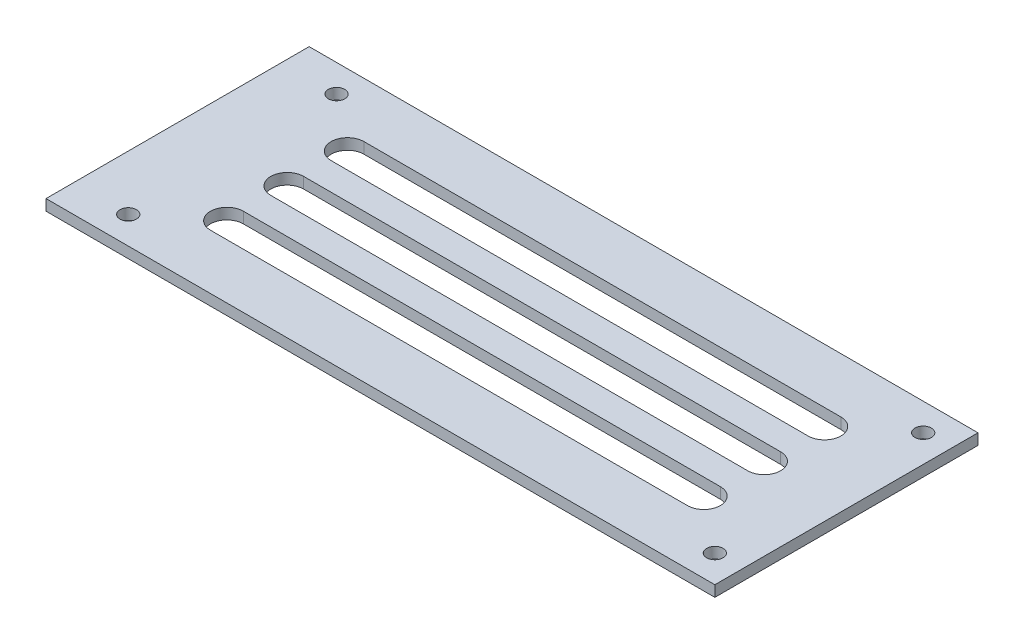
from build123d import *

# Parameters (mm, degrees)
SKETCH_1_W          = 122
SKETCH_1_H          = 48
SKETCH_1_R          = 1.5
EXTRUDE_1_DEPTH     = 2
CUT_EXTRUDE_1_DEPTH = 120.987499349


with BuildPart() as part:
    # 草图1 → 凸台-拉伸1 (new body)
    with BuildSketch(Plane(origin=(0, 0, 0), x_dir=(1, 0, 0), z_dir=(0, 1, 0))):
        with Locations((51, 19)):
            Rectangle(SKETCH_1_W, SKETCH_1_H)
        with Locations(Location((0, 38, 0), (0, 0, 270))):
            Circle(SKETCH_1_R, mode=Mode.SUBTRACT)
        with Locations(Location((0, 0, 0), (0, 0, 270))):
            Circle(SKETCH_1_R, mode=Mode.SUBTRACT)
        with Locations(Location((107, 38, 0), (0, 0, 270))):
            Circle(SKETCH_1_R, mode=Mode.SUBTRACT)
        with Locations(Location((107, 0, 0), (0, 0, 270))):
            Circle(SKETCH_1_R, mode=Mode.SUBTRACT)
    extrude(amount=EXTRUDE_1_DEPTH)

    # 草图2 → 切除-拉伸1 (cut, through all)
    with BuildSketch(Plane(origin=(0, 2, 0), x_dir=(1, 0, 0), z_dir=(0, 1, 0))):
        with BuildLine():
            Line((10, 33), (97, 33))
            ThreePointArc((97, 33), (100, 30), (97, 27))
            Line((97, 27), (10, 27))
            ThreePointArc((10, 27), (7, 30), (10, 33))
        make_face()
        with BuildLine():
            Line((10, 16), (97, 16))
            ThreePointArc((97, 16), (100, 19), (97, 22))
            Line((97, 22), (10, 22))
            ThreePointArc((10, 22), (7, 19), (10, 16))
        make_face()
        with BuildLine():
            Line((10, 5), (97, 5))
            ThreePointArc((97, 5), (100, 8), (97, 11))
            Line((97, 11), (10, 11))
            ThreePointArc((10, 11), (7, 8), (10, 5))
        make_face()
    extrude(amount=-CUT_EXTRUDE_1_DEPTH, mode=Mode.SUBTRACT)


solid = part.part
